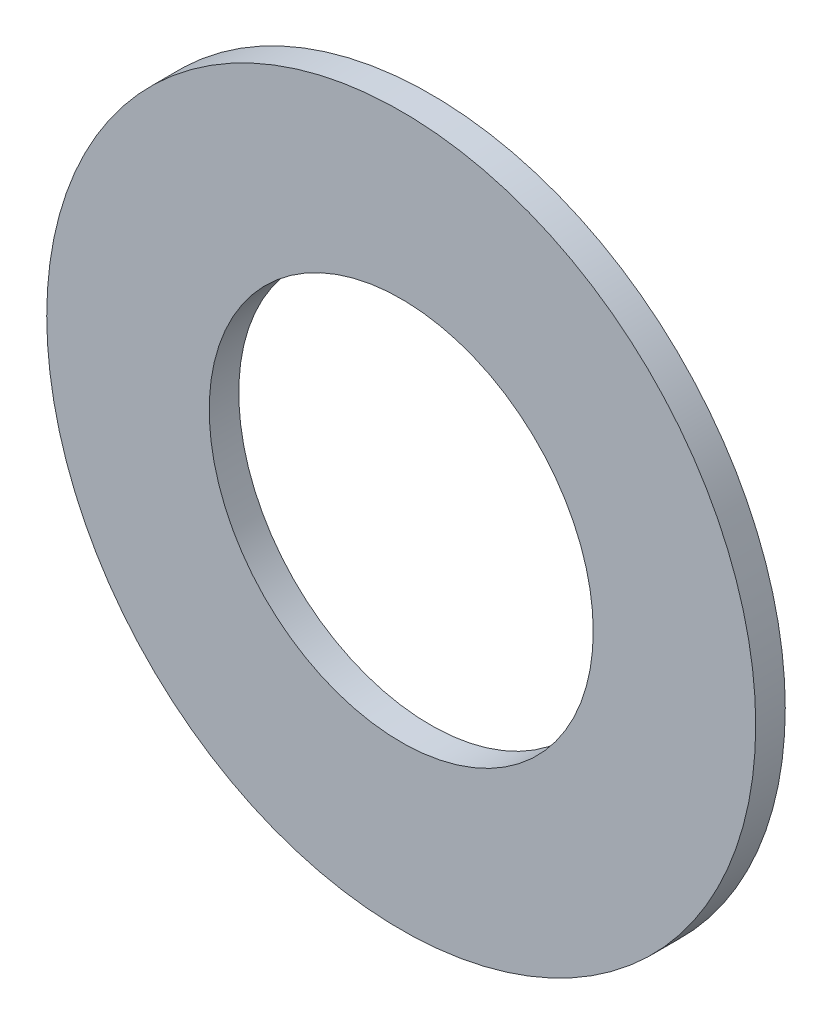
from build123d import *

# Parameters (mm, degrees)
ESQUISSE1_R        = 24
ESQUISSE1_R_2      = 13
BOSS_EXTRU_1_DEPTH = 2


with BuildPart() as part:
    # Esquisse1 → Boss.-Extru.1 (new body)
    with BuildSketch(Plane.XY):
        Circle(ESQUISSE1_R)
        Circle(ESQUISSE1_R_2, mode=Mode.SUBTRACT)
    extrude(amount=BOSS_EXTRU_1_DEPTH)


solid = part.part
